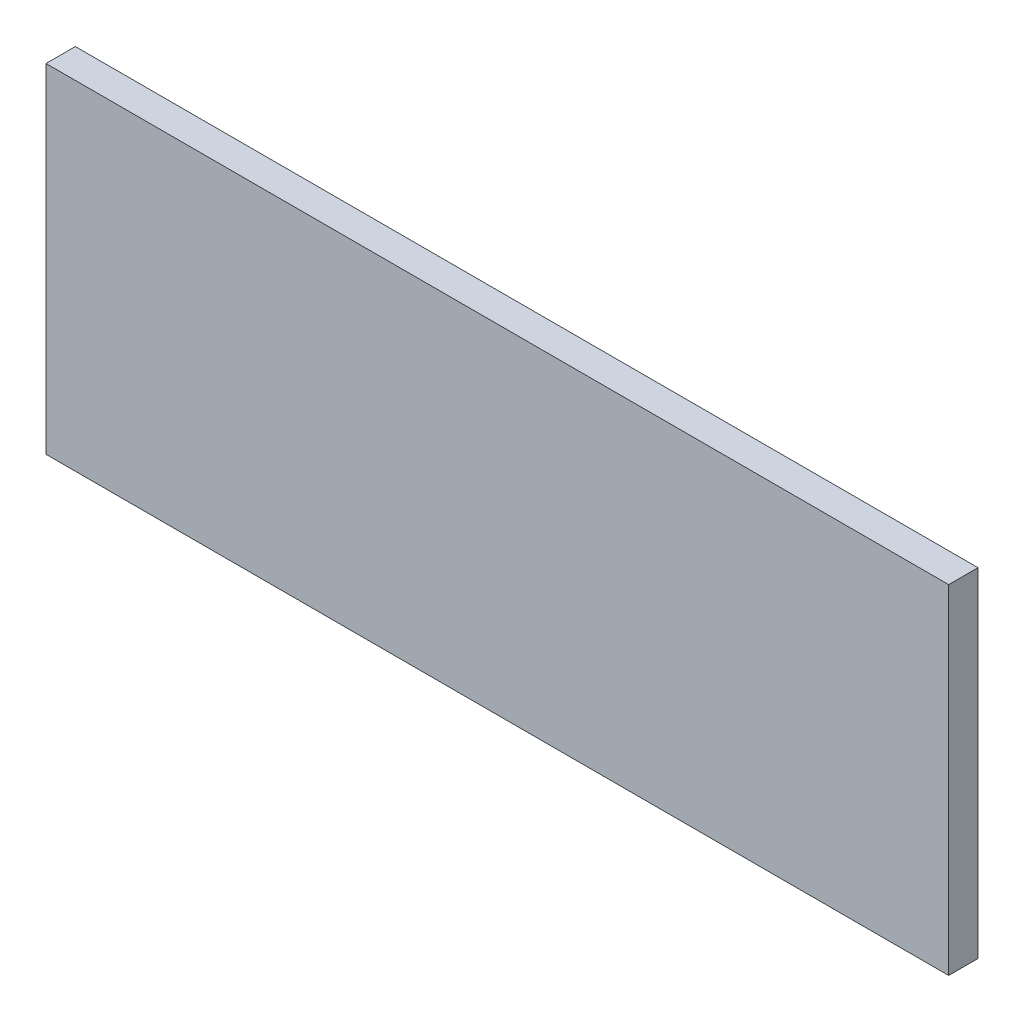
from build123d import *

# Parameters (mm, degrees)
SKETCH_1_W      = 400
SKETCH_1_H      = 150
SKETCH_1_W_2    = 380
SKETCH_1_H_2    = 130
EXTRUDE_1_DEPTH = 10
SKETCH_2_W      = 400
SKETCH_2_H      = 150
EXTRUDE_2_DEPTH = 3


with BuildPart() as part:
    # 스케치1 → 보스-돌출1 (new body)
    with BuildSketch(Plane.XY):
        Rectangle(SKETCH_1_W, SKETCH_1_H)
        Rectangle(SKETCH_1_W_2, SKETCH_1_H_2, mode=Mode.SUBTRACT)
    extrude(amount=EXTRUDE_1_DEPTH)

    # 스케치2 → 보스-돌출2 (add)
    with BuildSketch(Plane.XY.offset(10)):
        Rectangle(SKETCH_2_W, SKETCH_2_H)
    extrude(amount=EXTRUDE_2_DEPTH)


solid = part.part
